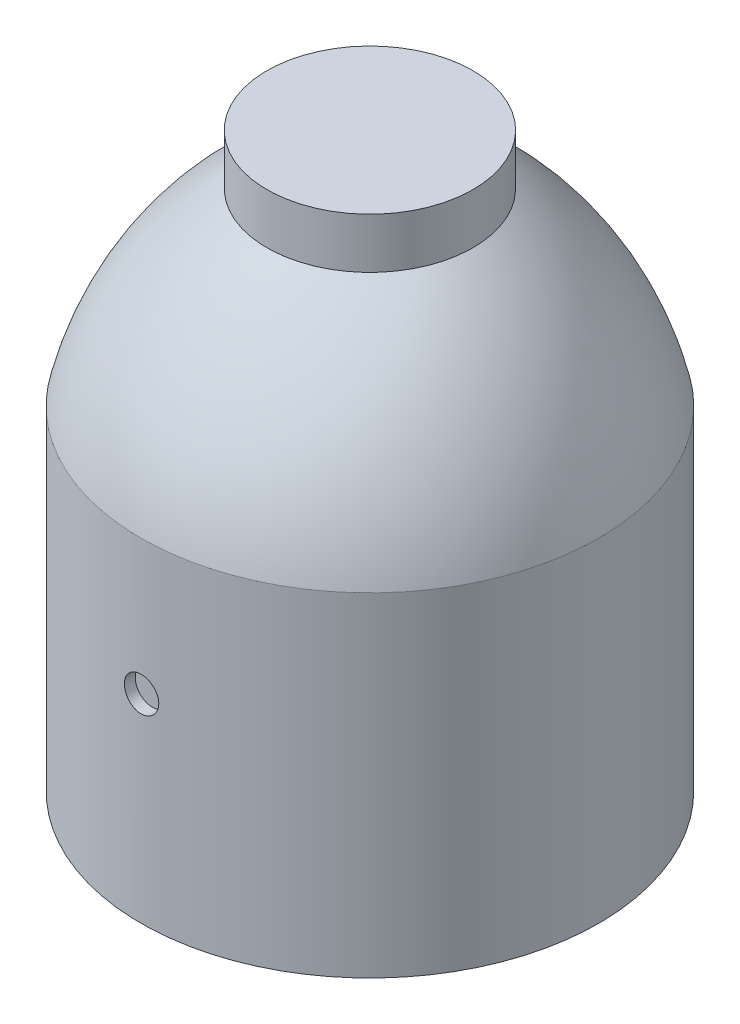
from build123d import *

# Parameters (mm, degrees)
SKETCH2_R          = 1.5
CUT_EXTRUDE1_DEPTH = 1


with BuildPart() as part:
    # Sketch1 → Revolve1 (revolve)
    with BuildSketch(Plane.XY, mode=Mode.PRIVATE) as revolve1_sk:
        with BuildLine():
            Line((20, 0), (20, 29.13905258))
            ThreePointArc((20, 29.13905258), (15.995992564, 38.368383693), (9, 45.598094362))
            Line((9, 45.598094362), (9, 50))
            Line((9, 50), (0, 50))
            Line((0, 50), (0, 43.972671684))
            Line((0, 43.972671684), (7.83466695, 43.972671684))
            ThreePointArc((7.83466695, 43.972671684), (14.270082218, 37.351024326), (18, 28.904220391))
            Line((18, 28.904220391), (18, 0))
            Line((18, 0), (20, 0))
        make_face()
    revolve(revolve1_sk.sketch.rotate(Axis((0, 0, 0), (0, 1, 0)), 90), axis=Axis((0, 0, 0), (0, 1, 0)))

    # Sketch2 → Cut-Extrude1 (cut)
    with BuildSketch(Plane.XY.offset(20)):
        with Locations((0, 17.347366398)):
            Circle(SKETCH2_R)
    extrude(amount=-CUT_EXTRUDE1_DEPTH, mode=Mode.SUBTRACT)


solid = part.part
